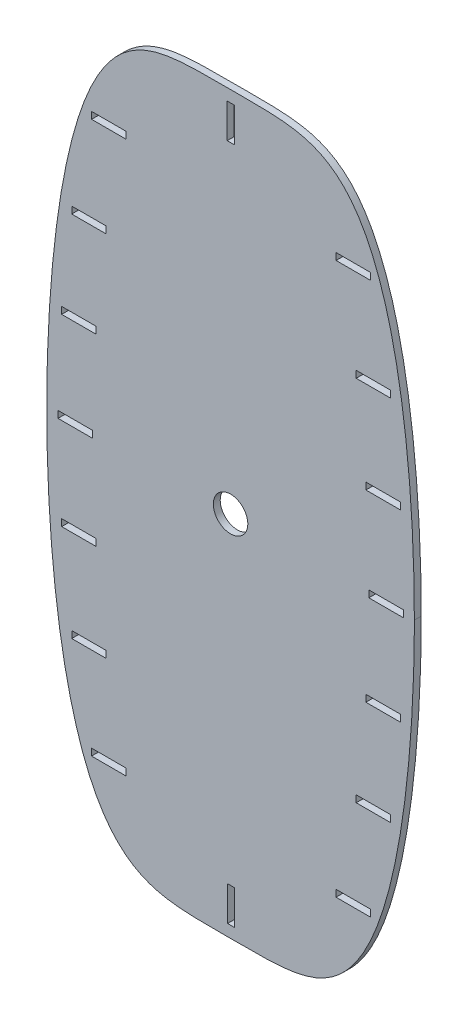
from build123d import *

# Parameters (mm, degrees)
EXTRUDE_1_DEPTH     = 3
SKETCH_3_W          = 3
SKETCH_3_H          = 15.000000006
SKETCH_3_W_2        = 15
SKETCH_3_H_2        = 3
SKETCH_3_W_3        = 15.00000006
SKETCH_3_W_4        = 15.031285664
SKETCH_3_H_3        = 2.98728904
SKETCH_3_W_5        = 3.139363819
SKETCH_3_H_4        = 14.933559722
CUT_EXTRUDE_1_DEPTH = 3
SKETCH_5_W          = 14.999999994
SKETCH_5_H          = 3
SKETCH_5_W_2        = 14.999999996
CUT_EXTRUDE_2_DEPTH = 3
SKETCH_7_R          = 7.5
CUT_EXTRUDE_3_DEPTH = 3


with BuildPart() as part:
    # 草图1 → 凸台-拉伸1 (new body)
    with BuildSketch(Plane.XY):
        with BuildLine():
            add(Edge.make_bspline(
                [(-80, 0), (-79.999999517, 6.699503197), (-79.813334657, 20.06627682), (-78.975827788, 40.103014347), (-76.900551884, 63.409443582), (-74.129426691, 83.257436743), (-71.298088169, 97.696692105), (-69.099286902, 106.811990018), (-66.70859783, 115.203996028), (-64.48936494, 121.902634073), (-61.776675321, 128.772853984), (-58.610309744, 135.208894491), (-55.748361383, 140.038637222), (-52.417983516, 144.692160649), (-48.644443211, 148.932654926), (-43.90188816, 152.895684545), (-38.638941508, 155.797422808), (-33.774046499, 157.55150664), (-29.437897495, 158.586138347), (-25.733934467, 159.185337458), (-22.051769463, 159.569060425), (-18.406326982, 159.797581877), (-14.053201072, 159.945194341), (-8.994603761, 159.999951963), (-3.232699743, 159.999952561), (3.232699743, 159.999952561), (8.994603761, 159.999951963), (14.053201071, 159.945194341), (18.406326982, 159.797581876), (22.051769464, 159.569060426), (25.733934469, 159.185337459), (29.437897495, 158.586138348), (33.77404647, 157.551506616), (38.638941617, 155.797422901), (43.901887855, 152.895684285), (48.644443968, 148.932655572), (52.417981042, 144.69215854), (55.748370939, 140.038645368), (58.610273081, 135.208863236), (61.776779921, 128.772943152), (64.4891488, 121.90244982), (66.709010037, 115.204347422), (70.013773512, 103.597451909), (73.433491394, 87.895578262), (76.604717125, 66.739177323), (78.975439873, 40.102683662), (79.813498867, 20.066416803), (79.999999517, 6.699503197), (80, 0)],
                knots=[0, 0, 0, 0, 0, 0.06499261, 0.129673422, 0.194485365, 0.226896468, 0.259307571, 0.272363931, 0.28542029, 0.311533009, 0.327739051, 0.343945093, 0.35493768, 0.365930268, 0.383191166, 0.398872304, 0.414552278, 0.42388233, 0.433212383, 0.442069116, 0.450925849, 0.459782581, 0.468639314, 0.484319657, 0.5, 0.515680343, 0.531360686, 0.540217419, 0.549074151, 0.557930884, 0.566787617, 0.57611767, 0.585447722, 0.601127696, 0.616808834, 0.634069732, 0.64506232, 0.656054907, 0.672260949, 0.688466991, 0.71457971, 0.727636069, 0.740692429, 0.805514635, 0.870326578, 0.93500739, 1, 1, 1, 1, 1], degree=4))
            add(Edge.make_bspline(
                [(-80, 0), (-79.999999517, -6.699503197), (-79.813334657, -20.06627682), (-78.975827788, -40.103014347), (-76.900551884, -63.409443582), (-74.129426691, -83.257436743), (-71.298088169, -97.696692105), (-69.099286902, -106.811990018), (-66.70859783, -115.203996028), (-64.48936494, -121.902634073), (-61.776675321, -128.772853984), (-58.610309744, -135.208894491), (-55.748361383, -140.038637222), (-52.417983516, -144.692160649), (-48.644443211, -148.932654926), (-43.90188816, -152.895684545), (-38.638941508, -155.797422808), (-33.774046499, -157.55150664), (-29.437897495, -158.586138347), (-25.733934467, -159.185337458), (-22.051769463, -159.569060425), (-18.406326982, -159.797581877), (-14.053201072, -159.945194341), (-8.994603761, -159.999951963), (-3.232699743, -159.999952561), (3.232699743, -159.999952561), (8.994603761, -159.999951963), (14.053201071, -159.945194341), (18.406326982, -159.797581876), (22.051769464, -159.569060426), (25.733934469, -159.185337459), (29.437897495, -158.586138348), (33.77404647, -157.551506616), (38.638941617, -155.797422901), (43.901887855, -152.895684285), (48.644443968, -148.932655572), (52.417981042, -144.69215854), (55.748370939, -140.038645368), (58.610273081, -135.208863236), (61.776779921, -128.772943152), (64.4891488, -121.90244982), (66.709010037, -115.204347422), (70.013773512, -103.597451909), (73.433491394, -87.895578262), (76.604717125, -66.739177323), (78.975439873, -40.102683662), (79.813498867, -20.066416803), (79.999999517, -6.699503197), (80, 0)],
                knots=[0, 0, 0, 0, 0, 0.06499261, 0.129673422, 0.194485365, 0.226896468, 0.259307571, 0.272363931, 0.28542029, 0.311533009, 0.327739051, 0.343945093, 0.35493768, 0.365930268, 0.383191166, 0.398872304, 0.414552278, 0.42388233, 0.433212383, 0.442069116, 0.450925849, 0.459782581, 0.468639314, 0.484319657, 0.5, 0.515680343, 0.531360686, 0.540217419, 0.549074151, 0.557930884, 0.566787617, 0.57611767, 0.585447722, 0.601127696, 0.616808834, 0.634069732, 0.64506232, 0.656054907, 0.672260949, 0.688466991, 0.71457971, 0.727636069, 0.740692429, 0.805514635, 0.870326578, 0.93500739, 1, 1, 1, 1, 1], degree=4))
        make_face()
    extrude(amount=EXTRUDE_1_DEPTH)

    # 草图3 → 切除-拉伸1 (cut)
    with BuildSketch(Plane.XY.offset(3)):
        with Locations((0.200366681, -147.500000003)):
            Rectangle(SKETCH_3_W, SKETCH_3_H)
        with Locations((53.405563639, -119.999999996)):
            Rectangle(SKETCH_3_W_2, SKETCH_3_H_2)
        with Locations((-53.004830277, -119.999999996)):
            Rectangle(SKETCH_3_W_2, SKETCH_3_H_2)
        with Locations((-65.999633294, -40.000000001)):
            Rectangle(SKETCH_3_W_2, SKETCH_3_H_2)
        with Locations((66.400366657, -40.000000001)):
            Rectangle(SKETCH_3_W_2, SKETCH_3_H_2)
        with Locations((67.700366711, 1e-09)):
            Rectangle(SKETCH_3_W_3, SKETCH_3_H_2)
        with Locations((66.400366657, 40.000000004)):
            Rectangle(SKETCH_3_W_2, SKETCH_3_H_2)
        with Locations((-67.577742522, 0)):
            Rectangle(SKETCH_3_W_4, SKETCH_3_H_2)
        with Locations((-65.999633294, 40.000000004)):
            Rectangle(SKETCH_3_W_2, SKETCH_3_H_2)
        with Locations((-52.980078329, 120.020205938)):
            Rectangle(SKETCH_3_W_2, SKETCH_3_H_3)
        with Locations((53.430315586, 120.020205938)):
            Rectangle(SKETCH_3_W_2, SKETCH_3_H_3)
        with Locations((0.130684772, 147.462472771)):
            Rectangle(SKETCH_3_W_5, SKETCH_3_H_4)
    extrude(amount=-CUT_EXTRUDE_1_DEPTH, mode=Mode.SUBTRACT)

    # 草图5 → 切除-拉伸2 (cut)
    with BuildSketch(Plane.XY.offset(3)):
        with Locations((-61.617760231, -80.000000002)):
            Rectangle(SKETCH_5_W, SKETCH_5_H)
        with Locations((62.182239751, -80.000000002)):
            Rectangle(SKETCH_5_W_2, SKETCH_5_H)
        with Locations((62.182239751, 80.000000005)):
            Rectangle(SKETCH_5_W_2, SKETCH_5_H)
        with Locations((-61.617760231, 80.000000005)):
            Rectangle(SKETCH_5_W, SKETCH_5_H)
    extrude(amount=-CUT_EXTRUDE_2_DEPTH, mode=Mode.SUBTRACT)

    # 草图7 → 切除-拉伸3 (cut)
    with BuildSketch(Plane(origin=(0, 0, 0), x_dir=(-1, 0, 0), z_dir=(0, 0, -1))):
        Circle(SKETCH_7_R)
    extrude(amount=-CUT_EXTRUDE_3_DEPTH, mode=Mode.SUBTRACT)


solid = part.part
